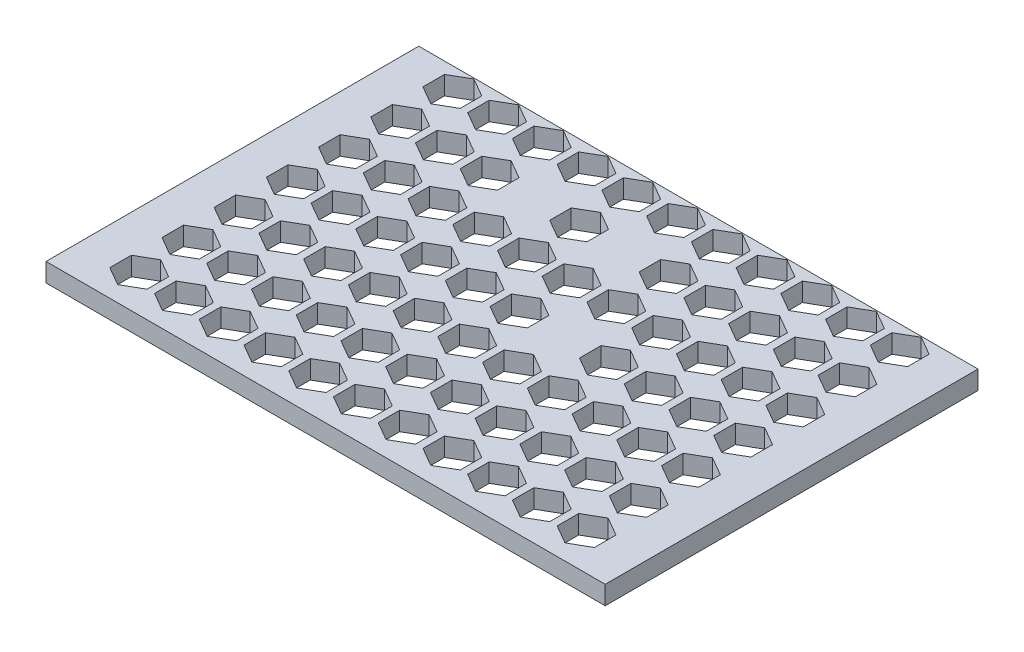
from build123d import *

# Parameters (mm, degrees)
SKETCH1_W            = 381
SKETCH1_H            = 254
BOSS_EXTRUDE1_DEPTH  = 12.7
CUT_EXTRUDE1_DEPTH   = 459.081095441
LPATTERN1_COUNT      = 11
LPATTERN1_PITCH      = 30.48
LPATTERN1_COUNT_DIR2 = 7
LPATTERN1_PITCH_DIR2 = 35.56


with BuildPart() as part:
    # Sketch1 → Boss-Extrude1 (new body)
    with BuildSketch(Plane(origin=(0, 0, 0), x_dir=(1, 0, 0), z_dir=(0, 1, 0))):
        with Locations((190.5, 127)):
            Rectangle(SKETCH1_W, SKETCH1_H)
    extrude(amount=BOSS_EXTRUDE1_DEPTH)

    # Sketch2 → Cut-Extrude1 (cut, through all)
    with BuildSketch(Plane(origin=(0, 12.7, 0), x_dir=(1, 0, 0), z_dir=(0, 1, 0))):
        Polygon((38.1, 10.735303163), (50.8, 18.067651581), (50.8, 32.732348419), (38.1, 40.064696837), (25.4, 32.732348419), (25.4, 18.067651581), align=None)
    cut_extrude1 = extrude(amount=-CUT_EXTRUDE1_DEPTH, mode=Mode.SUBTRACT)

    # LPattern1: Cut-Extrude1 11 × 7, 3 skipped
    with Locations(*[(i * LPATTERN1_PITCH, 0, -j * LPATTERN1_PITCH_DIR2) for i in range(LPATTERN1_COUNT) for j in range(LPATTERN1_COUNT_DIR2) if (i, j) not in ((0, 0), (3, 5), (5, 5), (6, 3))]):
        add(cut_extrude1, mode=Mode.SUBTRACT)


solid = part.part
